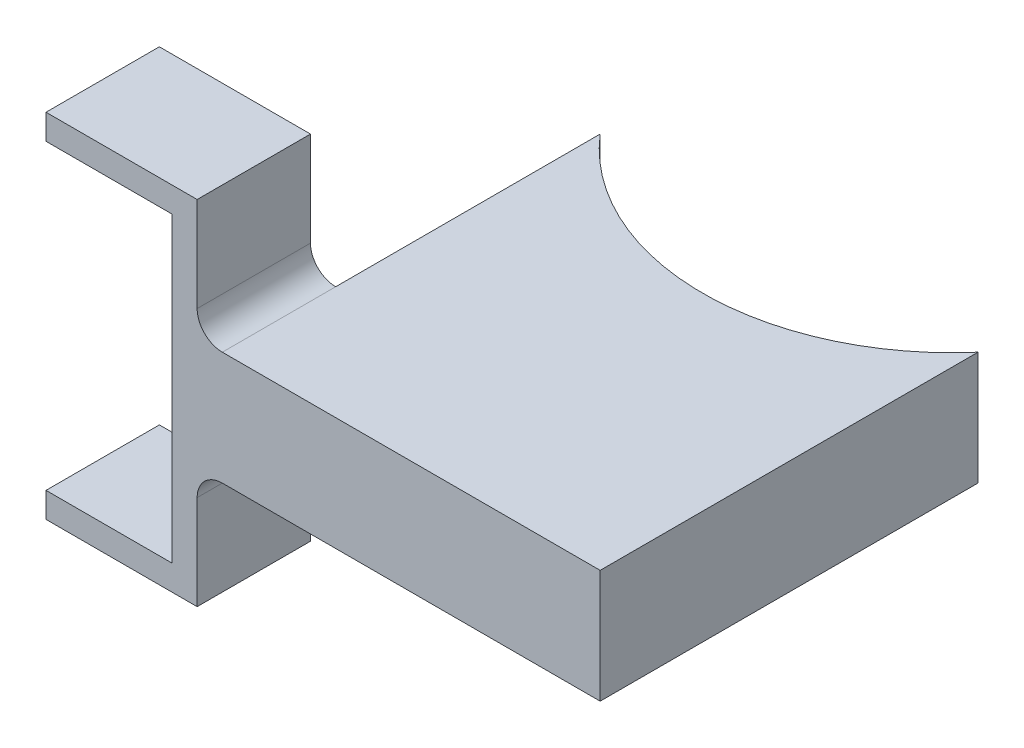
from build123d import *

# Parameters (mm, degrees)
EXTRUDE_1_DEPTH      = 9
SKETCH_2_W           = 9
SKETCH_2_H           = 9
EXTRUDE_2_DEPTH      = 2
EXTRUDE_5_DEPTH      = 9.5
EXTRUDE_5_DEPTH_BACK = 18.5
SKETCH_3_W           = 2
SKETCH_3_H           = 9
SKETCH_5_W           = 9
SKETCH_5_H           = 2
EXTRUDE_6_DEPTH      = 10
FILLET_2_R           = 2


with BuildPart() as part:
    # 草图1 → 凸台-拉伸1 (new body)
    with BuildSketch(Plane(origin=(0, 0, 0), x_dir=(1, 0, 0), z_dir=(0, 1, 0))):
        with BuildLine():
            ThreePointArc((15.854056032, 29.540059463), (0.854056032, 22.664455), (-14.145943968, 29.540059463))
            Line((-14.145943968, 29.540059463), (-14.145943968, -0.459940537))
            Line((-14.145943968, -0.459940537), (15.854056032, -0.459940537))
            Line((15.854056032, -0.459940537), (15.854056032, 29.540059463))
        make_face()
    extrude(amount=EXTRUDE_1_DEPTH)

    # 草图2 → 凸台-拉伸2 (add)
    with BuildSketch(Plane.ZY.offset(14.145943968)):
        with Locations((-4.040059463, 4.5)):
            Rectangle(SKETCH_2_W, SKETCH_2_H)
    extrude(amount=EXTRUDE_2_DEPTH)

    # 草图3 → 凸台-拉伸5 (add, two sides: drawn at the far end of the back side and taken through both)
    with BuildSketch(Plane(origin=(0, 9, 0), x_dir=(1, 0, 0), z_dir=(0, 1, 0)).offset(-EXTRUDE_5_DEPTH_BACK)):
        with Locations((-17.145943968, 4.040059463)):
            Rectangle(SKETCH_3_W, SKETCH_3_H)
    extrude(amount=EXTRUDE_5_DEPTH + EXTRUDE_5_DEPTH_BACK)

    # 草图5 → 凸台-拉伸6 (add)
    with BuildSketch(Plane.ZY.offset(18.145943968)):
        with Locations((-4.040059463, 17.5)):
            Rectangle(SKETCH_5_W, SKETCH_5_H)
        with Locations((-4.040059463, -8.5)):
            Rectangle(SKETCH_5_W, SKETCH_5_H)
    extrude(amount=EXTRUDE_6_DEPTH)

    # 圆角2
    fillet_2_edges = [part.edges().sort_by_distance(p)[0] for p in [
        (-16.145943968, 0, -4.040059463),
        (-16.145943968, 9, -4.040059463),
    ]]
    fillet(fillet_2_edges, radius=FILLET_2_R)


solid = part.part
